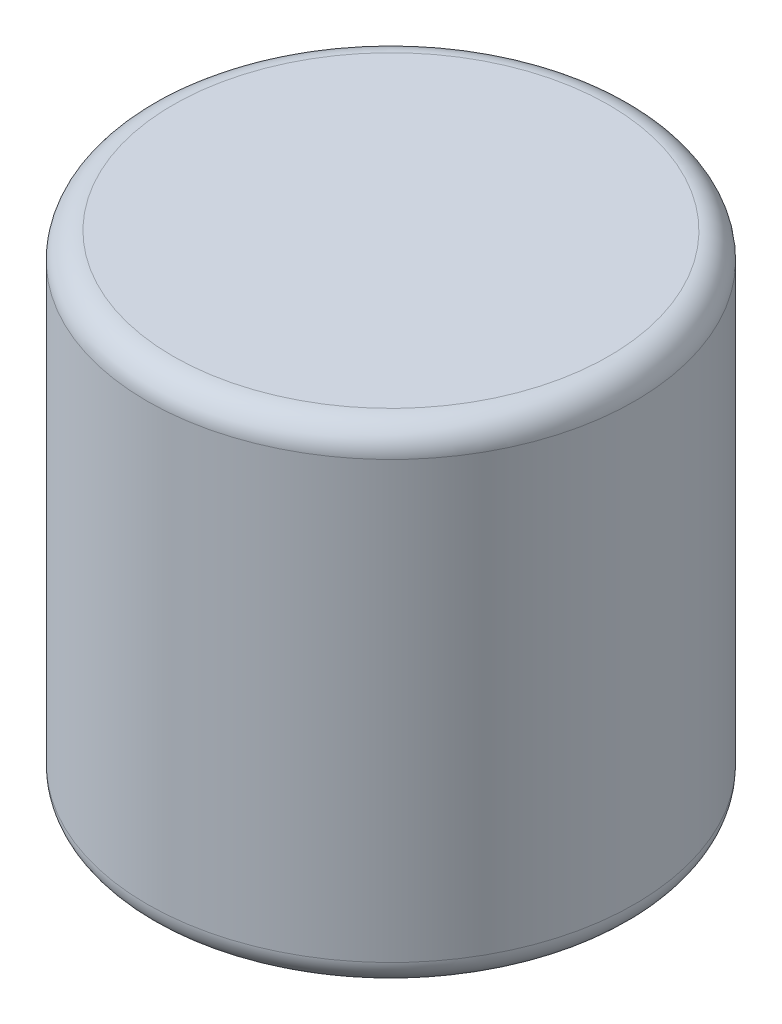
from build123d import *

# Parameters (mm, degrees)
SKETCH1_R           = 2.3876
BOSS_EXTRUDE1_DEPTH = 2.3876
FILLET1_R           = 0.254


with BuildPart() as part:
    # Sketch1 → Boss-Extrude1 (new, symmetric)
    with BuildSketch(Plane(origin=(0, 0, 0), x_dir=(1, 0, 0), z_dir=(0, 1, 0))):
        with Locations(Location((0, 0, 0), (0, 0, 270))):
            Circle(SKETCH1_R)
    extrude(amount=BOSS_EXTRUDE1_DEPTH, both=True)

    # Fillet1
    fillet1_edges = [part.edges().sort_by_distance(p)[0] for p in [
        (0, -2.3876, -2.3876),
        (0, 2.3876, -2.3876),
    ]]
    fillet(fillet1_edges, radius=FILLET1_R)


solid = part.part
